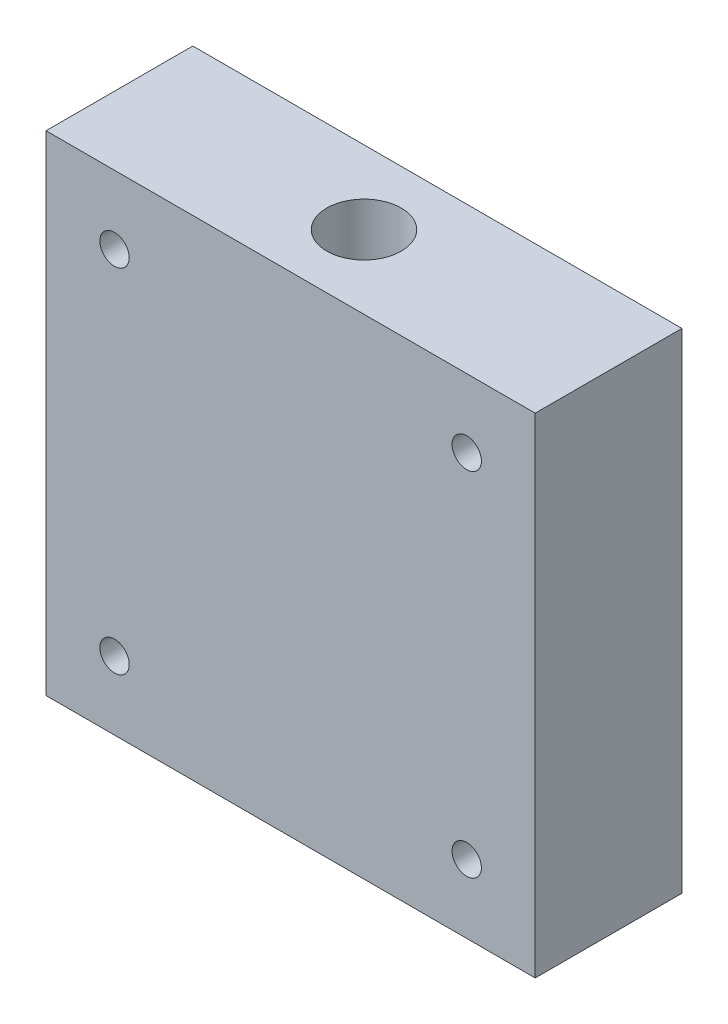
from build123d import *

# Parameters (mm, degrees)
ESBO_O1_W                = 50
ESBO_O1_H                = 50
RESSALTO_EXTRUS_O1_DEPTH = 15
ESBO_O2_R                = 3.815
CORTE_EXTRUS_O1_DEPTH    = 20
ESBO_O3_R                = 1.5
CORTE_EXTRUS_O2_DEPTH    = 39.405728739


with BuildPart() as part:
    # Esboço1 → Ressalto-extrusão1 (new body)
    with BuildSketch(Plane.XY):
        Rectangle(ESBO_O1_W, ESBO_O1_H)
    extrude(amount=RESSALTO_EXTRUS_O1_DEPTH)

    # Esboço2 → Corte-extrusão1 (cut)
    with BuildSketch(Plane(origin=(0, 25, 0), x_dir=(1, 0, 0), z_dir=(0, 1, 0))):
        with Locations(Location((0, -7.5, 0), (0, 0, 180))):
            Circle(ESBO_O2_R)
    extrude(amount=-CORTE_EXTRUS_O1_DEPTH, mode=Mode.SUBTRACT)

    # Esboço3 → Corte-extrusão2 (cut, through all)
    with BuildSketch(Plane.XY.offset(15)):
        with Locations((-18, 18)):
            Circle(ESBO_O3_R)
        with Locations((-18, -18)):
            Circle(ESBO_O3_R)
        with Locations((18, 18)):
            Circle(ESBO_O3_R)
        with Locations((18, -18)):
            Circle(ESBO_O3_R)
    extrude(amount=-CORTE_EXTRUS_O2_DEPTH, mode=Mode.SUBTRACT)


solid = part.part
